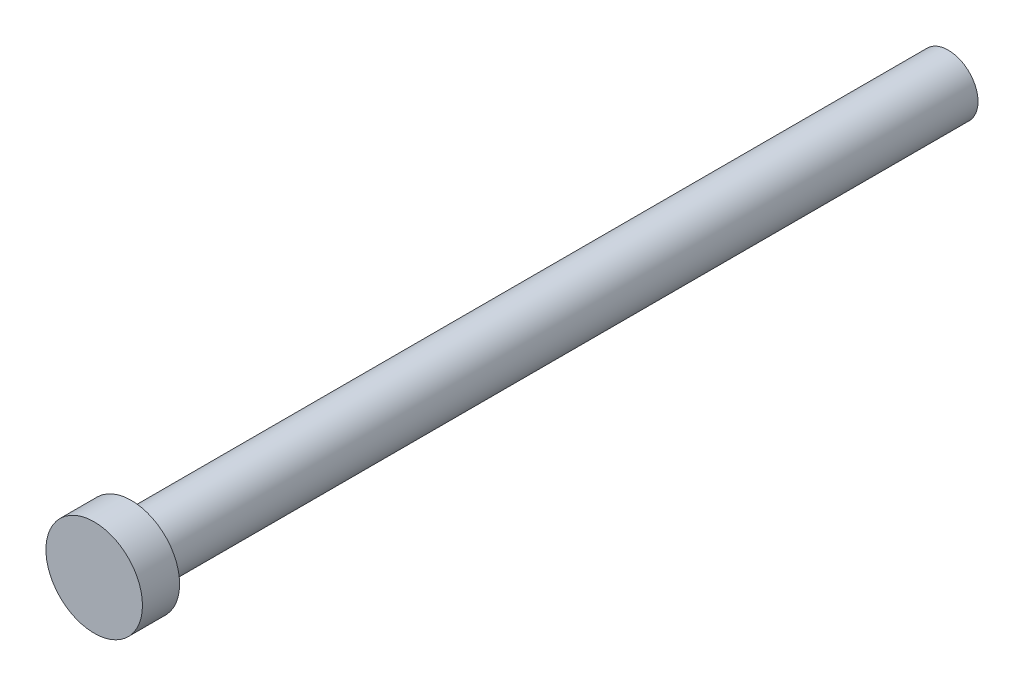
from build123d import *

# Parameters (mm, degrees)
SKETCH1_R           = 4
BOSS_EXTRUDE1_DEPTH = 110
SKETCH2_R           = 6.5
BOSS_EXTRUDE2_DEPTH = 5


with BuildPart() as part:
    # Sketch1 → Boss-Extrude1 (new body)
    with BuildSketch(Plane.XY):
        Circle(SKETCH1_R)
    extrude(amount=BOSS_EXTRUDE1_DEPTH)

    # Sketch2 → Boss-Extrude2 (add)
    with BuildSketch(Plane.XY.offset(110)):
        Circle(SKETCH2_R)
    extrude(amount=BOSS_EXTRUDE2_DEPTH)


solid = part.part
